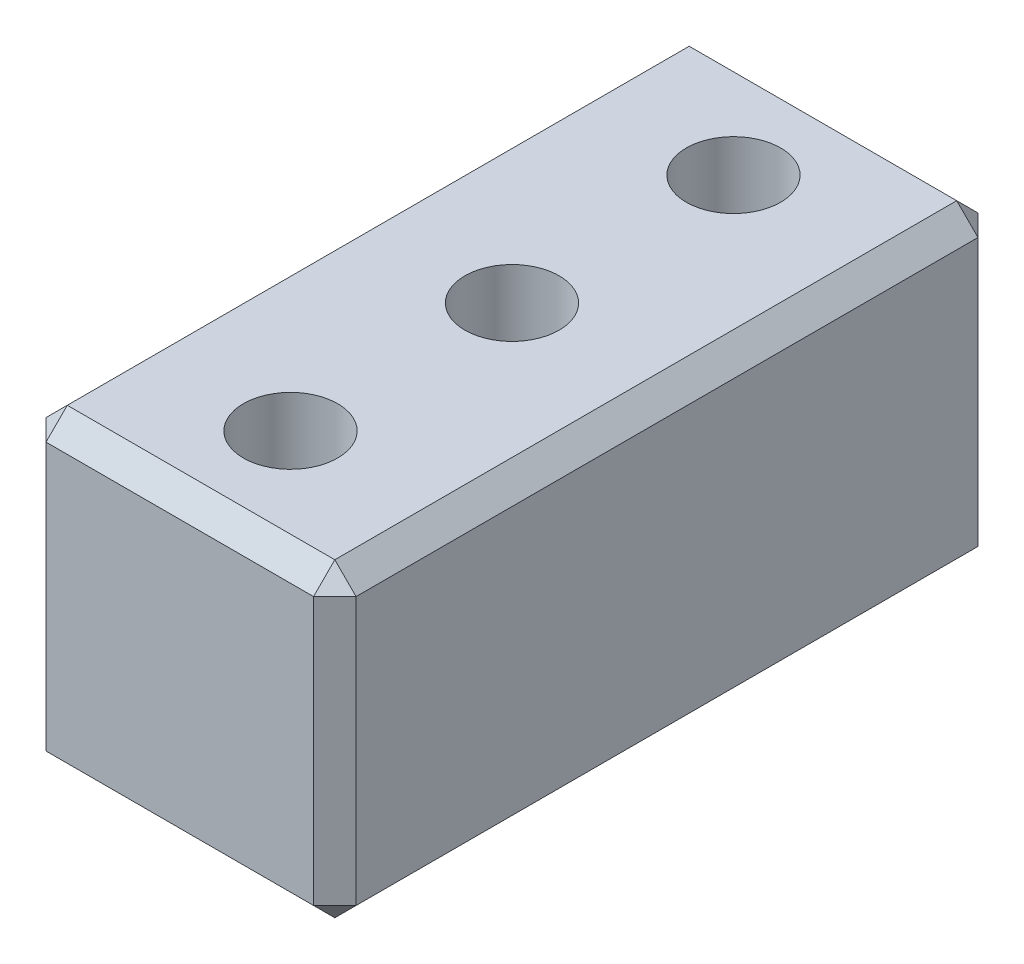
from build123d import *

# Parameters (mm, degrees)
SKETCH1_W               = 22.225
SKETCH1_H               = 22.225
BOSS_EXTRUDE1_DEPTH     = 23.8125
F_1_4_CLEARANCE_HOLE1_D = 6.7564
CHAMFER1_SIZE           = 1.524


with BuildPart() as part:
    # Sketch1 → Boss-Extrude1 (new, symmetric)
    with BuildSketch(Plane.XY):
        Rectangle(SKETCH1_W, SKETCH1_H)
    extrude(amount=BOSS_EXTRUDE1_DEPTH, both=True)

    # 1/4 Clearance Hole1 (through all)
    with Locations(Plane(origin=(0, 11.1125, 0), x_dir=(1, 0, 0), z_dir=(0, 1, 0))):
        with Locations((0, 15.875), (0, -15.875), (0, 0)):
            Hole(F_1_4_CLEARANCE_HOLE1_D / 2)

    # Chamfer1
    chamfer1_edges = [part.edges().sort_by_distance(p)[0] for p in [
        (11.1125, 0, 23.8125),
        (0, 11.1125, 23.8125),
        (-11.1125, 0, 23.8125),
        (0, 11.1125, -23.8125),
        (11.1125, 0, -23.8125),
        (0, -11.1125, -23.8125),
        (-11.1125, 0, -23.8125),
        (-11.1125, 11.1125, 0),
        (11.1125, 11.1125, 0),
        (11.1125, -11.1125, 0),
        (-11.1125, -11.1125, 0),
        (0, -11.1125, 23.8125),
    ]]
    chamfer(chamfer1_edges, length=CHAMFER1_SIZE)


solid = part.part
